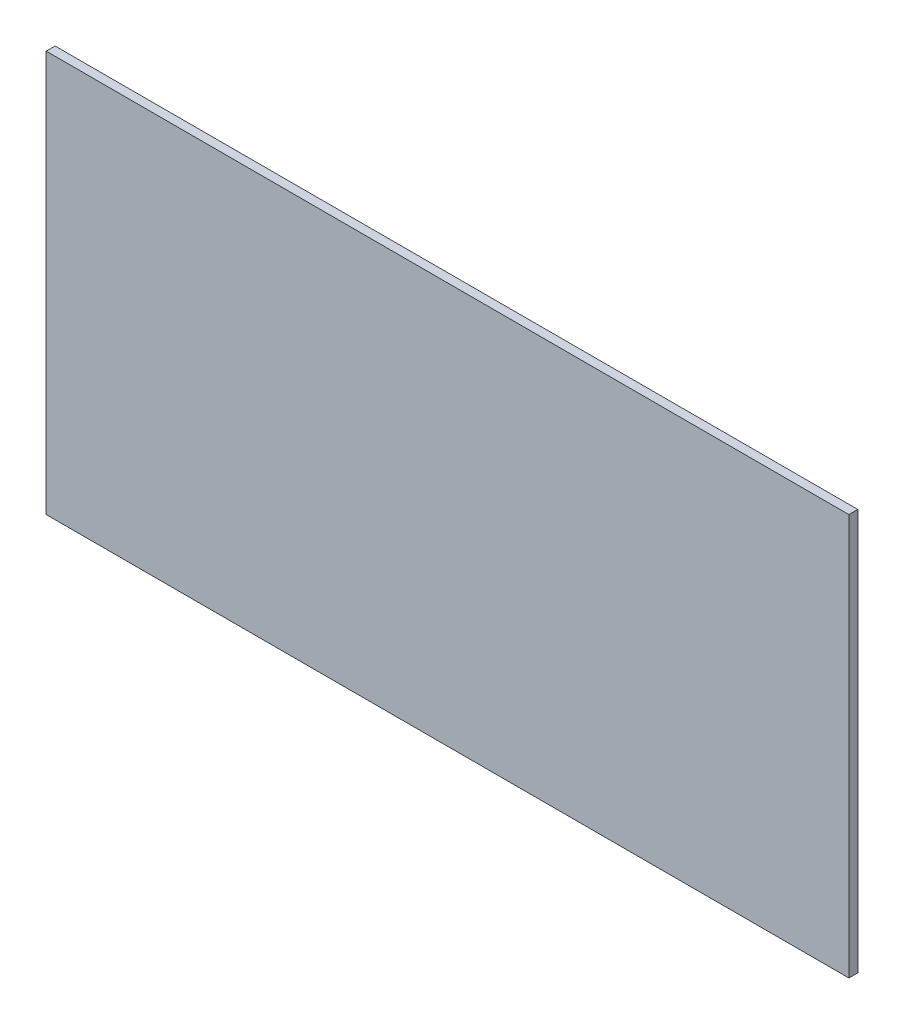
from build123d import *

# Parameters (mm, degrees)
SKETCH1_W           = 180
SKETCH1_H           = 90
BOSS_EXTRUDE1_DEPTH = 1


with BuildPart() as part:
    # Sketch1 → Boss-Extrude1 (new, symmetric)
    with BuildSketch(Plane.XY):
        Rectangle(SKETCH1_W, SKETCH1_H)
    extrude(amount=BOSS_EXTRUDE1_DEPTH, both=True)


solid = part.part
